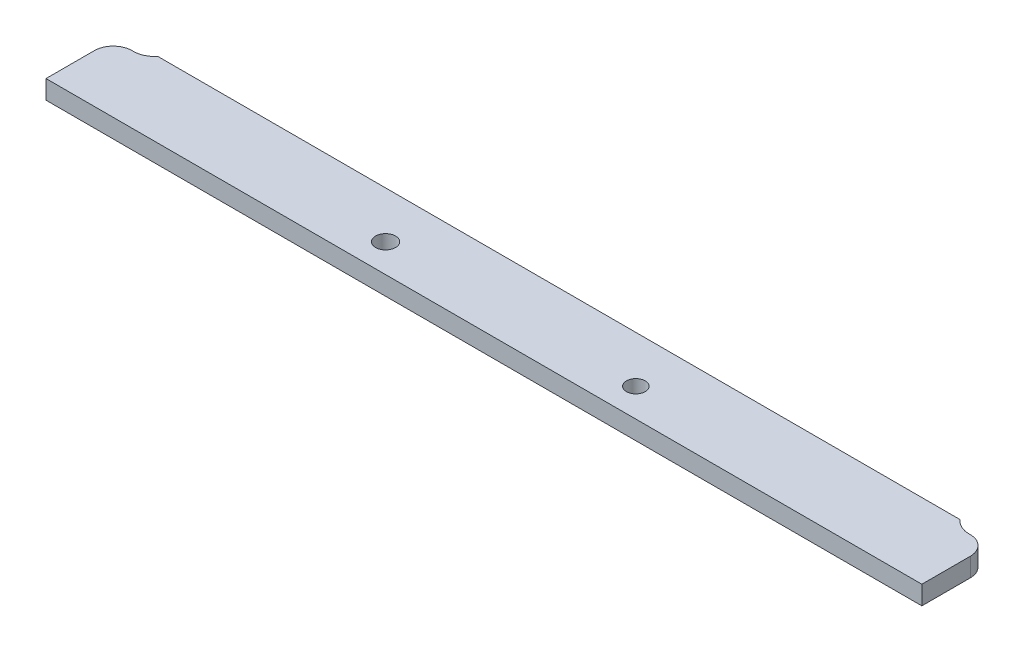
from build123d import *

# Parameters (mm, degrees)
BOSS_EXTRUDE1_DEPTH = 3
CUT_EXTRUDE1_REACH  = 136.027
SKETCH4_R           = 1.5


with BuildPart() as part:
    # Sketch3 → Boss-Extrude1 (new body)
    with BuildSketch(Plane(origin=(0, 0, 0), x_dir=(1, 0, 0), z_dir=(0, 1, 0))):
        with BuildLine():
            Line((125.49028015, 26.360794257), (-2.74094445, 26.360794257))
            ThreePointArc((-2.74094445, 26.360794257), (-3.945556452, 25.430743303), (-5.431022837, 25.099874039))
            Line((-5.431022837, 25.099874039), (-5.62533215, 25.099874039))
            ThreePointArc((-5.62533215, 25.099874039), (-7.746652493, 24.221194382), (-8.62533215, 22.099874039))
            Line((-8.62533215, 22.099874039), (-8.62533215, 14.358894177))
            Line((-8.62533215, 14.358894177), (131.37466785, 14.358894177))
            Line((131.37466785, 14.358894177), (131.37466785, 22.099874039))
            ThreePointArc((131.37466785, 22.099874039), (130.495988194, 24.221194382), (128.37466785, 25.099874039))
            Line((128.37466785, 25.099874039), (128.180358538, 25.099874039))
            ThreePointArc((128.180358538, 25.099874039), (126.694892152, 25.430743303), (125.49028015, 26.360794257))
        make_face()
    extrude(amount=BOSS_EXTRUDE1_DEPTH)

    # Sketch4 → Cut-Extrude1 (cut, up to next)
    with BuildSketch(Plane(origin=(0, 3, 0), x_dir=(1, 0, 0), z_dir=(0, 1, 0)), mode=Mode.PRIVATE) as cut_extrude1_sk1:
        with Locations(Location((81.109797099, 18.903114067, 0), (0, 0, 270))):
            Circle(SKETCH4_R)
    cut_extrude1_tool1 = extrude(cut_extrude1_sk1.sketch, amount=-CUT_EXTRUDE1_REACH, mode=Mode.PRIVATE) & part.part
    # Sketch4 → Cut-Extrude1 (cut, up to next)
    with BuildSketch(Plane(origin=(0, 3, 0), x_dir=(1, 0, 0), z_dir=(0, 1, 0)), mode=Mode.PRIVATE) as cut_extrude1_sk2:
        with BuildLine():
            ThreePointArc((41.109797099, 20.503114067), (39.509797099, 18.903114067), (41.109797099, 17.303114067))
            ThreePointArc((41.109797099, 17.303114067), (42.709797099, 18.903114067), (41.109797099, 20.503114067))
        make_face()
    cut_extrude1_tool2 = extrude(cut_extrude1_sk2.sketch, amount=-CUT_EXTRUDE1_REACH, mode=Mode.PRIVATE) & part.part
    add(cut_extrude1_tool1.solids().sort_by_distance((81.109797, 3, -18.903114))[0], mode=Mode.SUBTRACT)
    add(cut_extrude1_tool2.solids().sort_by_distance((41.109797, 3, -18.903114))[0], mode=Mode.SUBTRACT)


solid = part.part
